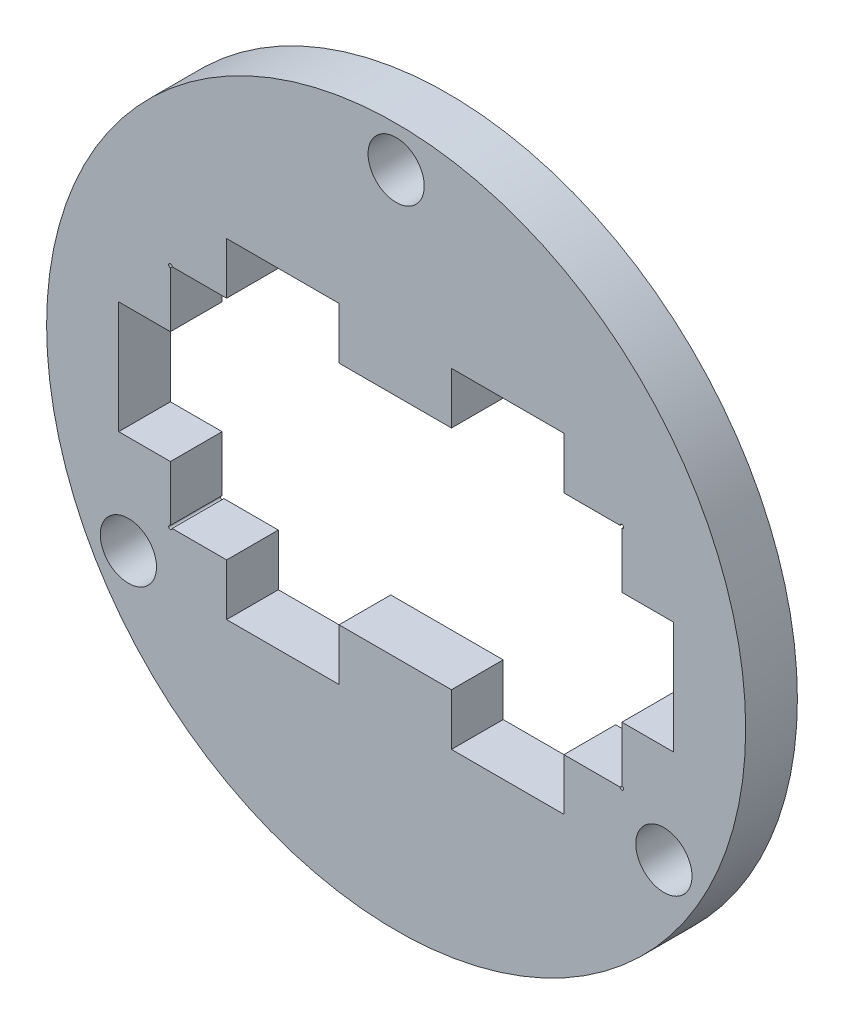
from build123d import *

# Parameters (mm, degrees)
SKETCH1_R           = 41.275
SKETCH1_R_2         = 3.175
BOSS_EXTRUDE1_DEPTH = 5.842
SKETCH7_R           = 41.275
SKETCH7_R_2         = 39.487499946
CUT_EXTRUDE3_DEPTH  = 59.663278241
SKETCH8_W           = 5.842
SKETCH8_H           = 12.7
SKETCH8_W_2         = 12.7
SKETCH8_H_2         = 5.842
CUT_EXTRUDE4_DEPTH  = 57.148501921


with BuildPart() as part:
    # Sketch1 → Boss-Extrude1 (new body)
    with BuildSketch(Plane.XY):
        Circle(SKETCH1_R)
        with Locations((0, 34.925)):
            Circle(SKETCH1_R_2, mode=Mode.SUBTRACT)
        with Locations((30.245937227, -17.4625)):
            Circle(SKETCH1_R_2, mode=Mode.SUBTRACT)
        with Locations((-30.245937227, -17.4625)):
            Circle(SKETCH1_R_2, mode=Mode.SUBTRACT)
        with BuildLine():
            Line((-25.3015625, -12.8), (25.3015625, -12.8))
            ThreePointArc((25.3015625, -12.8), (25.640316502, -12.940316502), (25.5, -12.6015625))
            Line((25.5, -12.6015625), (25.5, 12.6015625))
            ThreePointArc((25.5, 12.6015625), (25.640316502, 12.940316502), (25.3015625, 12.8))
            Line((25.3015625, 12.8), (-25.3015625, 12.8))
            ThreePointArc((-25.3015625, 12.8), (-25.640316502, 12.940316502), (-25.5, 12.6015625))
            Line((-25.5, 12.6015625), (-25.5, -12.6015625))
            ThreePointArc((-25.5, -12.6015625), (-25.640316502, -12.940316502), (-25.3015625, -12.8))
        make_face(mode=Mode.SUBTRACT)
    extrude(amount=BOSS_EXTRUDE1_DEPTH)

    # Sketch7 → Cut-Extrude3 (cut, through all)
    with BuildSketch(Plane(origin=(0, 0, 0), x_dir=(-1, 0, 0), z_dir=(0, 0, -1))):
        Circle(SKETCH7_R)
        Circle(SKETCH7_R_2, mode=Mode.SUBTRACT)
    extrude(amount=-CUT_EXTRUDE3_DEPTH, mode=Mode.SUBTRACT)

    # Sketch8 → Cut-Extrude4 (cut, through all)
    with BuildSketch(Plane(origin=(0, 0, 0), x_dir=(-1, 0, 0), z_dir=(0, 0, -1))):
        with Locations((-28.421, 0)):
            Rectangle(SKETCH8_W, SKETCH8_H)
        with Locations((-12.599996942, 15.721)):
            Rectangle(SKETCH8_W_2, SKETCH8_H_2)
        with Locations((12.800003058, 15.721)):
            Rectangle(SKETCH8_W_2, SKETCH8_H_2)
        with Locations((12.800003058, -15.721)):
            Rectangle(SKETCH8_W_2, SKETCH8_H_2)
        with Locations((-12.599996942, -15.721)):
            Rectangle(SKETCH8_W_2, SKETCH8_H_2)
        with Locations((28.421, 0)):
            Rectangle(SKETCH8_W, SKETCH8_H)
    extrude(amount=-CUT_EXTRUDE4_DEPTH, mode=Mode.SUBTRACT)


solid = part.part
